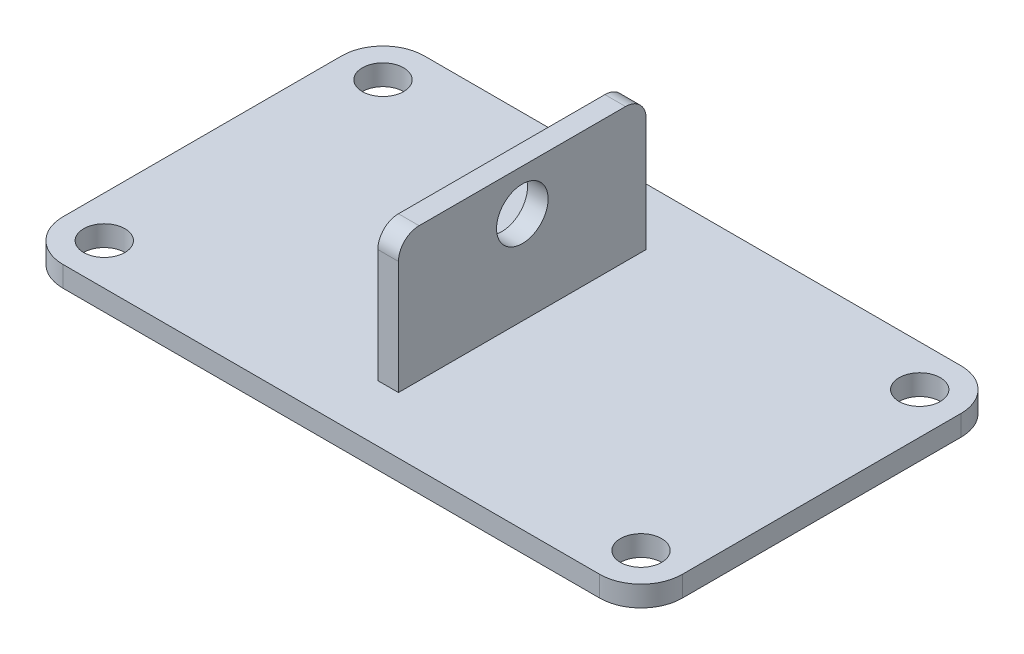
from build123d import *

# Parameters (mm, degrees)
SKETCH2_R           = 10
SKETCH2_W           = 10
SKETCH2_H           = 120
BOSS_EXTRUDE1_DEPTH = 10
SKETCH2_3_W         = 10
SKETCH2_3_H         = 120
BOSS_EXTRUDE2_DEPTH = 75
FILLET1_R           = 10
SKETCH3_R           = 12.5
CUT_EXTRUDE1_DEPTH  = 75


with BuildPart() as part:
    # Sketch2 → Boss-Extrude1 (new body)
    with BuildSketch(Plane(origin=(0, 0, 0), x_dir=(1, 0, 0), z_dir=(0, 1, 0))):
        with BuildLine():
            Line((-130, -87.5), (130, -87.5))
            ThreePointArc((130, -87.5), (144.142135624, -81.642135624), (150, -67.5))
            Line((150, -67.5), (150, 67.5))
            ThreePointArc((150, 67.5), (144.142135624, 81.642135624), (130, 87.5))
            Line((130, 87.5), (-130, 87.5))
            ThreePointArc((-130, 87.5), (-144.142135624, 81.642135624), (-150, 67.5))
            Line((-150, 67.5), (-150, -67.5))
            ThreePointArc((-150, -67.5), (-144.142135624, -81.642135624), (-130, -87.5))
        make_face()
        with Locations((130, 67.5)):
            Circle(SKETCH2_R, mode=Mode.SUBTRACT)
        with Locations((-130, 67.5)):
            Circle(SKETCH2_R, mode=Mode.SUBTRACT)
        with Locations((130, -67.5)):
            Circle(SKETCH2_R, mode=Mode.SUBTRACT)
        with Locations((-130, -67.5)):
            Circle(SKETCH2_R, mode=Mode.SUBTRACT)
        Rectangle(SKETCH2_W, SKETCH2_H, mode=Mode.SUBTRACT)
    extrude(amount=BOSS_EXTRUDE1_DEPTH)

    # Sketch2<3> → Boss-Extrude2 (add)
    with BuildSketch(Plane(origin=(0, 0, 0), x_dir=(1, 0, 0), z_dir=(0, 1, 0))):
        Rectangle(SKETCH2_3_W, SKETCH2_3_H)
    extrude(amount=BOSS_EXTRUDE2_DEPTH)

    # Fillet1
    fillet1_edges = [part.edges().sort_by_distance(p)[0] for p in [
        (0, 75, -60),
        (0, 75, 60),
    ]]
    fillet(fillet1_edges, radius=FILLET1_R)

    # Sketch3 → Cut-Extrude1 (cut)
    with BuildSketch(Plane(origin=(5, 0, 0), x_dir=(0, 0, -1), z_dir=(1, 0, 0))):
        with Locations((0, 55)):
            Circle(SKETCH3_R)
    extrude(amount=-CUT_EXTRUDE1_DEPTH, mode=Mode.SUBTRACT)


solid = part.part
